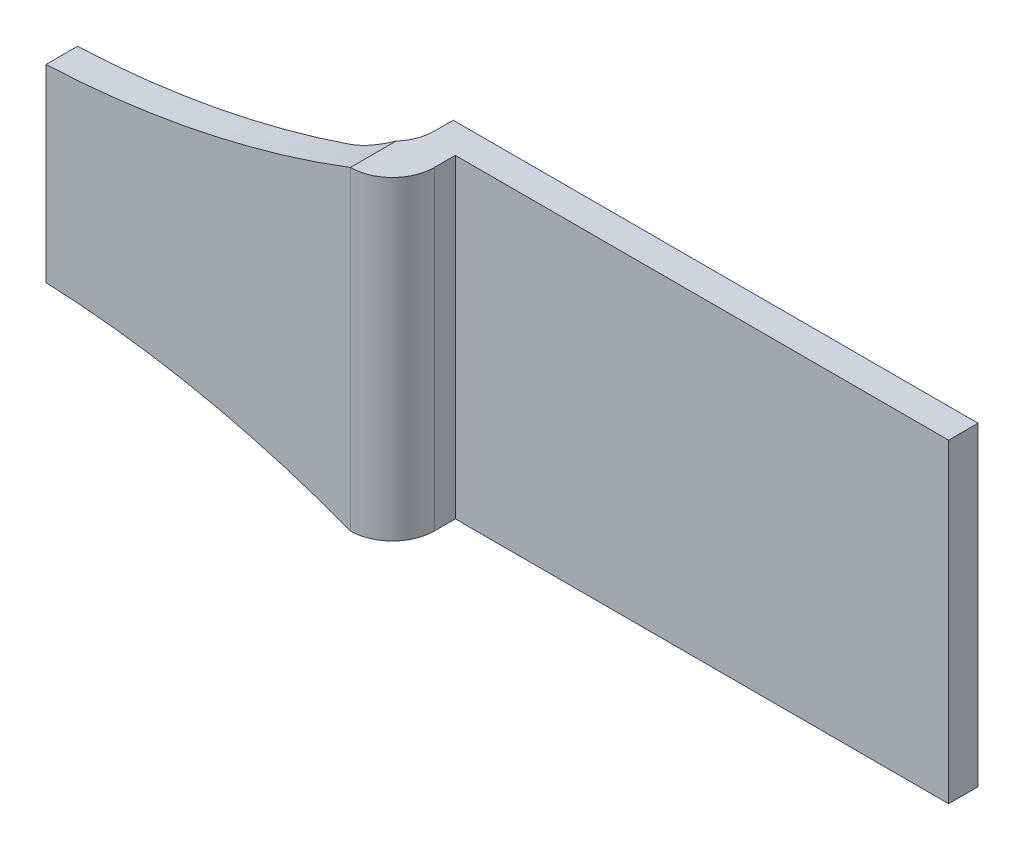
from build123d import *

# Parameters (mm, degrees)
CROQUIS1_W              = 25
CROQUIS1_H              = 15
SALIENTE_EXTRUIR1_DEPTH = 1.4
SALIENTE_EXTRUIR2_DEPTH = 15
REDONDEO1_R             = 2
CORTAR_EXTRUIR1_START   = -2.177124
CORTAR_EXTRUIR1_DEPTH   = 2.177124


with BuildPart() as part:
    # Croquis1 → Saliente-Extruir1 (new body)
    with BuildSketch(Plane.XY):
        with Locations((-66.695768458, 17.882653061)):
            Rectangle(CROQUIS1_W, CROQUIS1_H)
    extrude(amount=SALIENTE_EXTRUIR1_DEPTH)

    # Croquis3 → Saliente-Extruir2 (add)
    with BuildSketch(Plane.XZ.offset(-10.382653061)):
        Polygon((-79.195768458, 1.4), (-79.195768458, 2.9), (-94.195768458, 2.9), (-94.195768458, 4.4), (-77.695768458, 4.4), (-77.695768458, 1.4), align=None)
    extrude(amount=-SALIENTE_EXTRUIR2_DEPTH)

    # Redondeo1
    redondeo1_edges = [part.edges().sort_by_distance(p)[0] for p in [
        (-79.195768458, 17.882653061, 2.9),
        (-77.695768458, 17.882653061, 4.4),
    ]]
    fillet(redondeo1_edges, radius=REDONDEO1_R)

    # Croquis4 → Cortar-Extruir1 (cut)
    with BuildSketch(Plane.XY.offset(4.4).offset(CORTAR_EXTRUIR1_START)):
        with BuildLine():
            Line((-79.695768458, 25.382653061), (-94.195768458, 25.382653061))
            Line((-94.195768458, 25.382653061), (-94.195768458, 22.382653061))
            ThreePointArc((-94.195768458, 22.382653061), (-86.824341518, 23.295756187), (-79.695768458, 25.382653061))
        make_face()
        with BuildLine():
            Line((-94.195768458, 13.382653061), (-94.195768458, 10.382653061))
            Line((-94.195768458, 10.382653061), (-79.695768458, 10.382653061))
            ThreePointArc((-79.695768458, 10.382653061), (-86.824341518, 12.469549935), (-94.195768458, 13.382653061))
        make_face()
    extrude(amount=CORTAR_EXTRUIR1_DEPTH, mode=Mode.SUBTRACT)


solid = part.part
